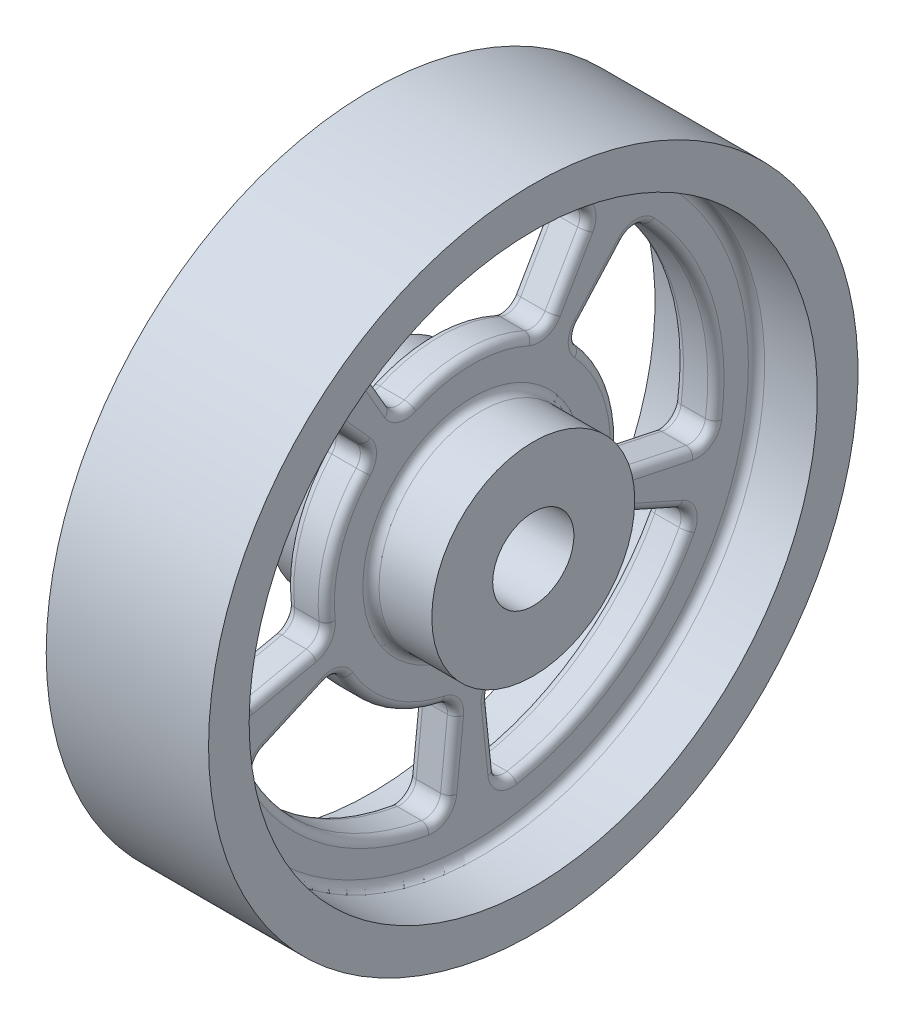
from build123d import *

# Parameters (mm, degrees)
CUT_EXTRUDE1_DEPTH       = 58.933151131
FILLET1_R                = 2
CIRPATTERN1_COUNT        = 5
FILLET1_OF_CIRPATTERN1_R = 2
FILLET2_R                = 1


with BuildPart() as part:
    # Sketch1 → Revolve1 (revolve)
    with BuildSketch(Plane(origin=(0, 0, 0), x_dir=(1, 0, 0), z_dir=(0, 1, 0)), mode=Mode.PRIVATE) as revolve1_sk:
        Polygon((2.5, 35), (10, 35), (10, 40), (-10, 40), (-10, 35), (-2.5, 35), (-2.5, 12.5), (-10, 12.5), (-10, 5), (10, 5), (10, 12.5), (2.5, 12.5), align=None)
    revolve(revolve1_sk.sketch.rotate(Axis((0, 0, 0), (1, 0, 0)), 180), axis=Axis((0, 0, 0), (1, 0, 0)))

    # Sketch2 → Cut-Extrude1 (cut, through all)
    with BuildSketch(Plane(origin=(2.5, 0, 0), x_dir=(0, 0, -1), z_dir=(1, 0, 0))):
        with BuildLine():
            Line((-9, 15.588457268), (-15, 25.980762114))
            ThreePointArc((-15, 25.980762114), (0, 30), (15, 25.980762114))
            Line((15, 25.980762114), (9, 15.588457268))
            ThreePointArc((9, 15.588457268), (0, 18), (-9, 15.588457268))
        make_face()
    cut_extrude1 = extrude(amount=-CUT_EXTRUDE1_DEPTH, mode=Mode.SUBTRACT)

    # Fillet1
    fillet1_edges = [part.edges().sort_by_distance(p)[0] for p in [
        (0, 15.588457268, -9),
        (0, 15.588457268, 9),
        (0, 25.980762114, 15),
        (0, 25.980762114, -15),
    ]]
    fillet(fillet1_edges, radius=FILLET1_R)

    # CirPattern1: Cut-Extrude1 ×5 about axis
    cirpattern1_axis = Axis((0, 0, 0), (1, 0, 0))
    for i in range(1, CIRPATTERN1_COUNT):
        add(cut_extrude1.rotate(cirpattern1_axis, i * 360 / CIRPATTERN1_COUNT), mode=Mode.SUBTRACT)

    # Fillet1 of CirPattern1
    fillet1_of_cirpattern1_edges = [part.edges().sort_by_distance(p)[0] for p in [
        (0, 13.376606859, 12.044350914),
        (0, -3.742410435, 17.606656813),
        (0, -6.237350725, 29.344428022),
        (0, 22.294344764, 20.073918191),
        (0, -7.321259575, 16.443818238),
        (0, -17.901394117, 1.881512339),
        (0, -29.835656861, 3.135853898),
        (0, -12.202099292, 27.406363729),
        (0, -17.901394117, -1.881512339),
        (0, -7.321259575, -16.443818238),
        (0, -12.202099292, -27.406363729),
        (0, -29.835656861, -3.135853898),
        (0, -3.742410435, -17.606656813),
        (0, 13.376606859, -12.044350914),
        (0, 22.294344764, -20.073918191),
        (0, -6.237350725, -29.344428022),
    ]]
    fillet(fillet1_of_cirpattern1_edges, radius=FILLET1_OF_CIRPATTERN1_R)

    # Fillet2
    fillet2_edges = [part.edges().sort_by_distance(p)[0] for p in [
        (2.5, 0, -35),
        (2.5, 0, -12.5),
        (2.5, 9.270509831, -28.531695489),
        (-2.5, 9.270509831, -28.531695489),
        (2.5, -4.972023962, -23.391533639),
        (-2.5, -4.972023962, -23.391533639),
        (2.5, 5.562305899, -17.119017293),
        (-2.5, 5.562305899, -17.119017293),
        (2.5, 17.771650383, -16.001665879),
        (-2.5, 17.771650383, -16.001665879),
        (2.5, -5.487704354, -28.882524769),
        (-2.5, -5.487704354, -28.882524769),
        (2.5, -3.352979753, -18.260009279),
        (-2.5, -3.352979753, -18.260009279),
        (2.5, 21.416368191, -20.14086169),
        (-2.5, 21.416368191, -20.14086169),
        (2.5, 13.445581763, -12.801825774),
        (-2.5, 13.445581763, -12.801825774),
        (2.5, -24.270509831, -17.633557569),
        (-2.5, -24.270509831, -17.633557569),
        (2.5, -23.783110394, -2.49970563),
        (-2.5, -23.783110394, -2.49970563),
        (2.5, -14.562305899, -10.580134541),
        (-2.5, -14.562305899, -10.580134541),
        (2.5, -9.726746619, -21.846630597),
        (-2.5, -9.726746619, -21.846630597),
        (2.5, -29.164707294, -3.706074009),
        (-2.5, -29.164707294, -3.706074009),
        (2.5, -18.402428538, -2.453779941),
        (-2.5, -18.402428538, -2.453779941),
        (2.5, -12.537076026, -26.592045067),
        (-2.5, -12.537076026, -26.592045067),
        (2.5, -8.020346559, -16.743489875),
        (-2.5, -8.020346559, -16.743489875),
        (2.5, -24.270509831, 17.633557569),
        (-2.5, -24.270509831, 17.633557569),
        (2.5, -9.726746619, 21.846630597),
        (-2.5, -9.726746619, 21.846630597),
        (2.5, -14.562305899, 10.580134541),
        (-2.5, -14.562305899, 10.580134541),
        (2.5, -23.783110394, 2.49970563),
        (-2.5, -23.783110394, 2.49970563),
        (2.5, -12.537076026, 26.592045067),
        (-2.5, -12.537076026, 26.592045067),
        (2.5, -8.020346559, 16.743489875),
        (-2.5, -8.020346559, 16.743489875),
        (2.5, -29.164707294, 3.706074009),
        (-2.5, -29.164707294, 3.706074009),
        (2.5, -18.402428538, 2.453779941),
        (-2.5, -18.402428538, 2.453779941),
        (2.5, 9.270509831, 28.531695489),
        (-2.5, 9.270509831, 28.531695489),
        (2.5, 17.771650383, 16.001665879),
        (-2.5, 17.771650383, 16.001665879),
        (2.5, 5.562305899, 17.119017293),
        (-2.5, 5.562305899, 17.119017293),
        (2.5, -4.972023962, 23.391533639),
        (-2.5, -4.972023962, 23.391533639),
        (2.5, 21.416368191, 20.14086169),
        (-2.5, 21.416368191, 20.14086169),
        (2.5, 13.445581763, 12.801825774),
        (-2.5, 13.445581763, 12.801825774),
        (2.5, -5.487704354, 28.882524769),
        (-2.5, -5.487704354, 28.882524769),
        (2.5, -3.352979753, 18.260009279),
        (-2.5, -3.352979753, 18.260009279),
        (2.5, 30, 0),
        (-2.5, 30, 0),
        (2.5, 20.710230592, -11.957057207),
        (-2.5, 20.710230592, -11.957057207),
        (2.5, 18, 0),
        (-2.5, 18, 0),
        (2.5, 20.710230592, 11.957057207),
        (-2.5, 20.710230592, 11.957057207),
        (2.5, 25.773119483, -14.14430798),
        (-2.5, 25.773119483, -14.14430798),
        (2.5, 16.330173087, -8.831526428),
        (-2.5, 16.330173087, -8.831526428),
        (2.5, 25.773119483, 14.14430798),
        (-2.5, 25.773119483, 14.14430798),
        (2.5, 16.330173087, 8.831526428),
        (-2.5, 16.330173087, 8.831526428),
        (-2.5, 0, -12.5),
        (-2.5, 0, -35),
    ]]
    fillet(fillet2_edges, radius=FILLET2_R)


solid = part.part
